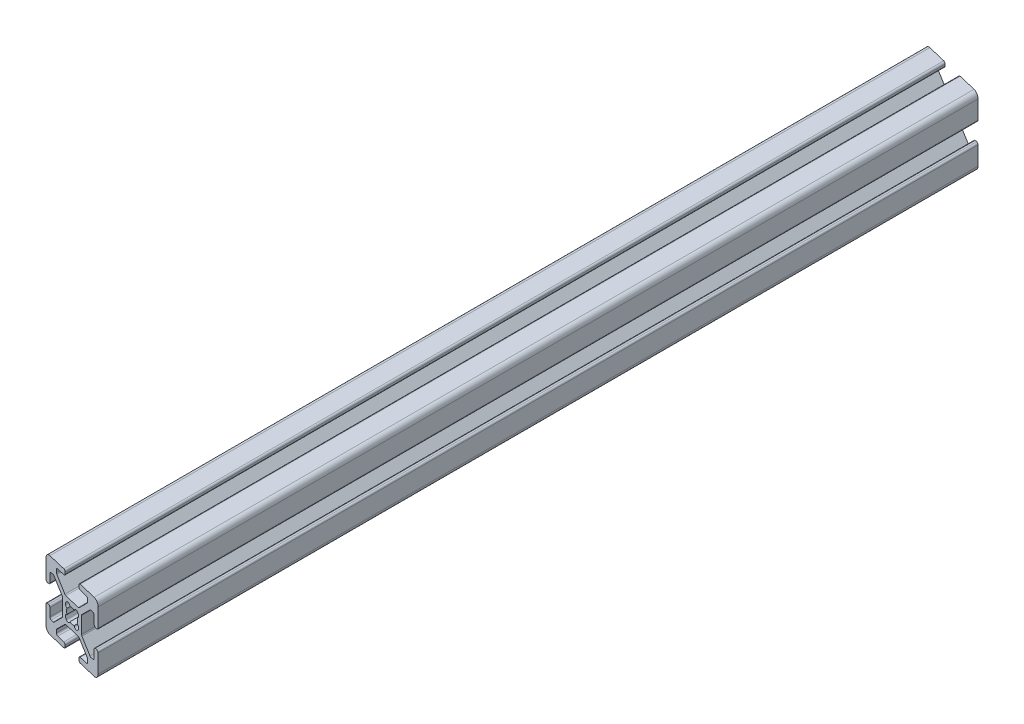
from build123d import *

# Parameters (mm, degrees)
BOSS_EXTRUDE1_DEPTH = 261.8
CUT_EXTRUDE1_DEPTH  = 4001.062499512


with BuildPart() as part:
    # Sketch1 → Boss-Extrude1 (new body)
    with BuildSketch(Plane.XY.offset(4000)):
        with BuildLine():
            Line((10, 3.138), (10, 8.5))
            ThreePointArc((10, 8.5), (9.560660172, 9.560660172), (8.5, 10))
            Line((8.5, 10), (3.138, 10))
            ThreePointArc((3.138, 10), (2.778789755, 9.851210245), (2.63, 9.492))
            Line((2.63, 9.492), (2.63, 9.008))
            ThreePointArc((2.63, 9.008), (2.778789755, 8.648789755), (3.138, 8.5))
            Line((3.138, 8.5), (5.487, 8.5))
            ThreePointArc((5.487, 8.5), (5.846210245, 8.351210245), (5.995, 7.992))
            Line((5.995, 7.992), (5.995, 7.266080661))
            ThreePointArc((5.995, 7.266080661), (5.956330803, 7.071677478), (5.846210245, 6.906870417))
            Line((5.846210245, 6.906870417), (2.743129583, 3.803789755))
            ThreePointArc((2.743129583, 3.803789755), (2.578322522, 3.693669197), (2.383919339, 3.655))
            Line((2.383919339, 3.655), (-2.383919339, 3.655))
            ThreePointArc((-2.383919339, 3.655), (-2.578322522, 3.693669197), (-2.743129583, 3.803789755))
            Line((-2.743129583, 3.803789755), (-5.846210245, 6.906870417))
            ThreePointArc((-5.846210245, 6.906870417), (-5.956330803, 7.071677478), (-5.995, 7.266080661))
            Line((-5.995, 7.266080661), (-5.995, 7.992))
            ThreePointArc((-5.995, 7.992), (-5.846210245, 8.351210245), (-5.487, 8.5))
            Line((-5.487, 8.5), (-3.138, 8.5))
            ThreePointArc((-3.138, 8.5), (-2.778789755, 8.648789755), (-2.63, 9.008))
            Line((-2.63, 9.008), (-2.63, 9.492))
            ThreePointArc((-2.63, 9.492), (-2.778789755, 9.851210245), (-3.138, 10))
            Line((-3.138, 10), (-8.5, 10))
            ThreePointArc((-8.5, 10), (-9.560660172, 9.560660172), (-10, 8.5))
            Line((-10, 8.5), (-10, 3.138))
            ThreePointArc((-10, 3.138), (-9.851210245, 2.778789755), (-9.492, 2.63))
            Line((-9.492, 2.63), (-9.008, 2.63))
            ThreePointArc((-9.008, 2.63), (-8.648789755, 2.778789755), (-8.5, 3.138))
            Line((-8.5, 3.138), (-8.5, 5.487))
            ThreePointArc((-8.5, 5.487), (-8.351210245, 5.846210245), (-7.992, 5.995))
            Line((-7.992, 5.995), (-7.266080661, 5.995))
            ThreePointArc((-7.266080661, 5.995), (-7.071677478, 5.956330803), (-6.906870417, 5.846210245))
            Line((-6.906870417, 5.846210245), (-3.803789755, 2.743129583))
            ThreePointArc((-3.803789755, 2.743129583), (-3.693669197, 2.578322522), (-3.655, 2.383919339))
            Line((-3.655, 2.383919339), (-3.655, -2.383919339))
            ThreePointArc((-3.655, -2.383919339), (-3.693669197, -2.578322522), (-3.803789755, -2.743129583))
            Line((-3.803789755, -2.743129583), (-6.906870417, -5.846210245))
            ThreePointArc((-6.906870417, -5.846210245), (-7.071677478, -5.956330803), (-7.266080661, -5.995))
            Line((-7.266080661, -5.995), (-7.992, -5.995))
            ThreePointArc((-7.992, -5.995), (-8.351210245, -5.846210245), (-8.5, -5.487))
            Line((-8.5, -5.487), (-8.5, -3.138))
            ThreePointArc((-8.5, -3.138), (-8.648789755, -2.778789755), (-9.008, -2.63))
            Line((-9.008, -2.63), (-9.492, -2.63))
            ThreePointArc((-9.492, -2.63), (-9.851210245, -2.778789755), (-10, -3.138))
            Line((-10, -3.138), (-10, -8.5))
            ThreePointArc((-10, -8.5), (-9.560660172, -9.560660172), (-8.5, -10))
            Line((-8.5, -10), (-3.138, -10))
            ThreePointArc((-3.138, -10), (-2.778789755, -9.851210245), (-2.63, -9.492))
            Line((-2.63, -9.492), (-2.63, -9.008))
            ThreePointArc((-2.63, -9.008), (-2.778789755, -8.648789755), (-3.138, -8.5))
            Line((-3.138, -8.5), (-5.487, -8.5))
            ThreePointArc((-5.487, -8.5), (-5.846210245, -8.351210245), (-5.995, -7.992))
            Line((-5.995, -7.992), (-5.995, -7.266080661))
            ThreePointArc((-5.995, -7.266080661), (-5.956330803, -7.071677478), (-5.846210245, -6.906870417))
            Line((-5.846210245, -6.906870417), (-2.743129583, -3.803789755))
            ThreePointArc((-2.743129583, -3.803789755), (-2.578322522, -3.693669197), (-2.383919339, -3.655))
            Line((-2.383919339, -3.655), (2.383919339, -3.655))
            ThreePointArc((2.383919339, -3.655), (2.578322522, -3.693669197), (2.743129583, -3.803789755))
            Line((2.743129583, -3.803789755), (5.846210245, -6.906870417))
            ThreePointArc((5.846210245, -6.906870417), (5.956330803, -7.071677478), (5.995, -7.266080661))
            Line((5.995, -7.266080661), (5.995, -7.992))
            ThreePointArc((5.995, -7.992), (5.846210245, -8.351210245), (5.487, -8.5))
            Line((5.487, -8.5), (3.138, -8.5))
            ThreePointArc((3.138, -8.5), (2.778789755, -8.648789755), (2.63, -9.008))
            Line((2.63, -9.008), (2.63, -9.492))
            ThreePointArc((2.63, -9.492), (2.778789755, -9.851210245), (3.138, -10))
            Line((3.138, -10), (8.5, -10))
            ThreePointArc((8.5, -10), (9.560660172, -9.560660172), (10, -8.5))
            Line((10, -8.5), (10, -3.138))
            ThreePointArc((10, -3.138), (9.851210245, -2.778789755), (9.492, -2.63))
            Line((9.492, -2.63), (9.008, -2.63))
            ThreePointArc((9.008, -2.63), (8.648789755, -2.778789755), (8.5, -3.138))
            Line((8.5, -3.138), (8.5, -5.487))
            ThreePointArc((8.5, -5.487), (8.351210245, -5.846210245), (7.992, -5.995))
            Line((7.992, -5.995), (7.266080661, -5.995))
            ThreePointArc((7.266080661, -5.995), (7.071677478, -5.956330803), (6.906870417, -5.846210245))
            Line((6.906870417, -5.846210245), (3.803789755, -2.743129583))
            ThreePointArc((3.803789755, -2.743129583), (3.693669197, -2.578322522), (3.655, -2.383919339))
            Line((3.655, -2.383919339), (3.655, 2.383919339))
            ThreePointArc((3.655, 2.383919339), (3.693669197, 2.578322522), (3.803789755, 2.743129583))
            Line((3.803789755, 2.743129583), (6.906870417, 5.846210245))
            ThreePointArc((6.906870417, 5.846210245), (7.071677478, 5.956330803), (7.266080661, 5.995))
            Line((7.266080661, 5.995), (7.992, 5.995))
            ThreePointArc((7.992, 5.995), (8.351210245, 5.846210245), (8.5, 5.487))
            Line((8.5, 5.487), (8.5, 3.138))
            ThreePointArc((8.5, 3.138), (8.648789755, 2.778789755), (9.008, 2.63))
            Line((9.008, 2.63), (9.492, 2.63))
            ThreePointArc((9.492, 2.63), (9.851210245, 2.778789755), (10, 3.138))
        make_face()
        with BuildLine():
            Line((-2.124900844, -2.304505966), (-2.304505966, -2.124900844))
            ThreePointArc((-2.304505966, -2.124900844), (-2.505938017, -1.356467811), (-1.935133506, -0.803976718))
            ThreePointArc((-1.935133506, -0.803976718), (-2.0955, 0), (-1.935133506, 0.803976718))
            ThreePointArc((-1.935133506, 0.803976718), (-2.505938017, 1.356467811), (-2.304505966, 2.124900844))
            Line((-2.304505966, 2.124900844), (-2.124900844, 2.304505966))
            ThreePointArc((-2.124900844, 2.304505966), (-1.356467811, 2.505938017), (-0.803976718, 1.935133506))
            ThreePointArc((-0.803976718, 1.935133506), (0, 2.0955), (0.803976718, 1.935133506))
            ThreePointArc((0.803976718, 1.935133506), (1.356467811, 2.505938017), (2.124900844, 2.304505966))
            Line((2.124900844, 2.304505966), (2.304505966, 2.124900844))
            ThreePointArc((2.304505966, 2.124900844), (2.505938017, 1.356467811), (1.935133506, 0.803976718))
            ThreePointArc((1.935133506, 0.803976718), (2.0955, 0), (1.935133506, -0.803976718))
            ThreePointArc((1.935133506, -0.803976718), (2.505938017, -1.356467811), (2.304505966, -2.124900844))
            Line((2.304505966, -2.124900844), (2.124900844, -2.304505966))
            ThreePointArc((2.124900844, -2.304505966), (1.356467811, -2.505938017), (0.803976718, -1.935133506))
            ThreePointArc((0.803976718, -1.935133506), (0, -2.0955), (-0.803976718, -1.935133506))
            ThreePointArc((-0.803976718, -1.935133506), (-1.356467811, -2.505938017), (-2.124900844, -2.304505966))
        make_face(mode=Mode.SUBTRACT)
    extrude(amount=-BOSS_EXTRUDE1_DEPTH)

    # Sketch2 → Cut-Extrude1 (cut, through all)
    with BuildSketch(Plane.XZ.offset(10)):
        Polygon((10, 4000), (-10, 3995.213189756), (-10, 4000), align=None)
        Polygon((10, 3738.2), (10, 3742.986810244), (-10, 3738.2), align=None)
    extrude(amount=-CUT_EXTRUDE1_DEPTH, mode=Mode.SUBTRACT)


solid = part.part
